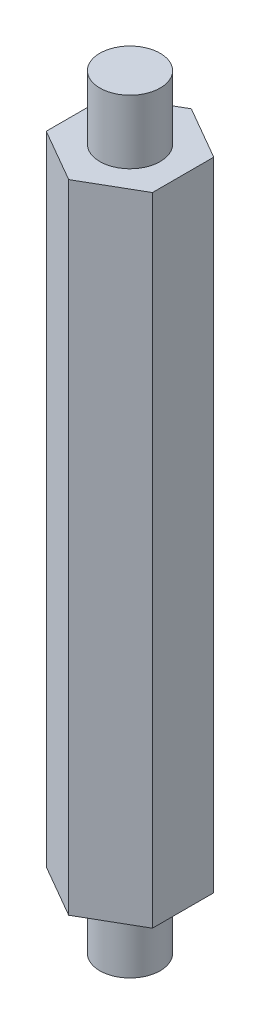
from build123d import *

# Parameters (mm, degrees)
BOSS_EXTRUDE1_DEPTH = 30
SKETCH3_R           = 1.42
BOSS_EXTRUDE2_DEPTH = 3
BOSS_EXTRUDE3_START = 3
SKETCH4_R           = 1.42
BOSS_EXTRUDE3_DEPTH = 3


with BuildPart() as part:
    # Sketch2 → Boss-Extrude1 (new body)
    with BuildSketch(Plane(origin=(0, 0, 0), x_dir=(1, 0, 0), z_dir=(0, 1, 0))):
        Polygon((0, 2.886751346), (-2.5, 1.443375673), (-2.5, -1.443375673), (0, -2.886751346), (2.5, -1.443375673), (2.5, 1.443375673), align=None)
    extrude(amount=BOSS_EXTRUDE1_DEPTH)

    # Sketch3 → Boss-Extrude2 (add)
    with BuildSketch(Plane(origin=(0, 30, 0), x_dir=(1, 0, 0), z_dir=(0, 1, 0))):
        with Locations(Location((0, 0, 0), (0, 0, 270))):
            Circle(SKETCH3_R)
    extrude(amount=BOSS_EXTRUDE2_DEPTH)

    # Sketch4 → Boss-Extrude3 (add)
    with BuildSketch(Plane(origin=(0, 0, 0), x_dir=(-1, 0, 0), z_dir=(0, -1, 0)).offset(BOSS_EXTRUDE3_START)):
        with Locations(Location((0, 0, 0), (0, 0, 270))):
            Circle(SKETCH4_R)
    extrude(amount=-BOSS_EXTRUDE3_DEPTH)


solid = part.part
